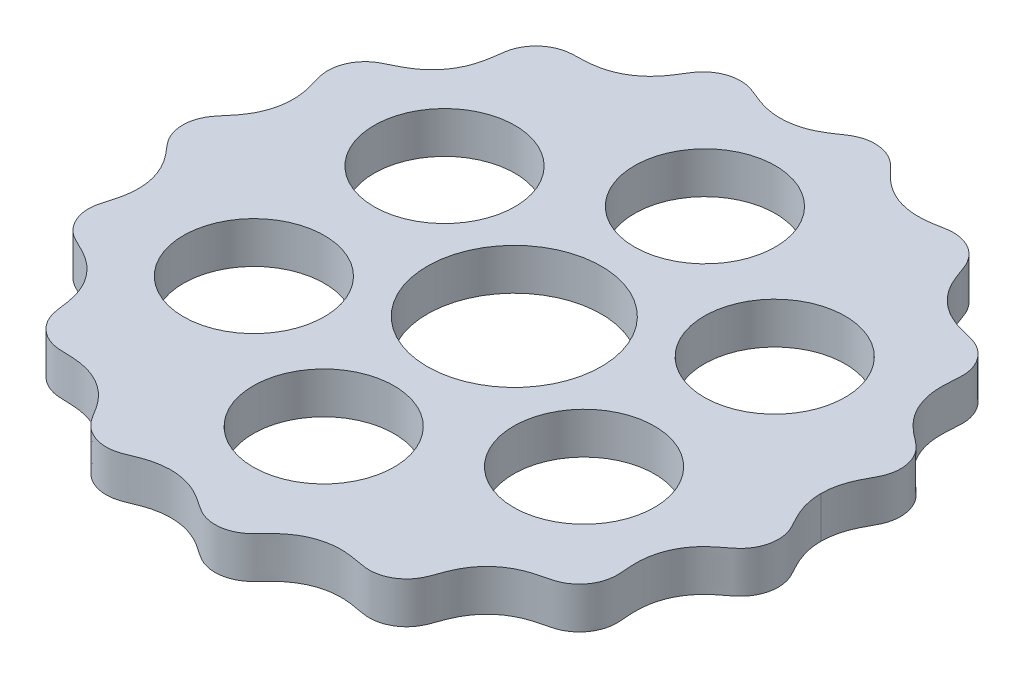
from build123d import *

# Parameters (mm, degrees)
SKETCH1_R           = 10.5
SKETCH1_R_2         = 8.5
BOSS_EXTRUDE1_DEPTH = 5


with BuildPart() as part:
    # Sketch1 → Boss-Extrude1 (new body)
    with BuildSketch(Plane(origin=(0, 0, 0), x_dir=(1, 0, 0), z_dir=(0, 1, 0))):
        with BuildLine():
            add(Edge.make_bspline(
                [(37, 0), (37, -0.03143727), (37.000453604, -0.094999987), (37.002494823, -0.209960319), (37.007935699, -0.365962041), (37.018130067, -0.547435978), (37.035778539, -0.762613663), (37.062295011, -1.000704503), (37.099596576, -1.254145629), (37.141666769, -1.490121949), (37.186730566, -1.707704996), (37.27599878, -2.086217996), (37.432607644, -2.61967024), (37.650272858, -3.191702622), (37.93344139, -3.795551093), (38.205952219, -4.315706499), (38.450459887, -4.76062227), (38.70692772, -5.235202277), (38.941768984, -5.756697541), (39.137855891, -6.378800099), (39.247955338, -7.103857197), (39.228570469, -7.939956238), (39.019285386, -8.855824089), (38.577559758, -9.823505319), (37.820964583, -10.754370621), (36.848063751, -11.434964366), (35.925475538, -12.170726431), (35.15516003, -12.931370117), (34.54379505, -13.69507461), (33.895237033, -14.741994379), (33.428420875, -15.89037885), (33.16127245, -17.104145416), (33.090755906, -18.276711654), (33.117928675, -19.134785899), (33.184630754, -19.922725011), (33.242632466, -20.644624385), (33.219628568, -21.437875666), (33.036316371, -22.28173929), (32.662226146, -23.128482681), (32.07870968, -23.926433825), (31.270520944, -24.647504284), (30.212930356, -25.19576041), (29.05618735, -25.42594367), (27.921165014, -25.714783041), (26.912865036, -26.088040866), (26.04670806, -26.526543792), (25.231490798, -27.070153578), (24.486296273, -27.71622491), (23.823206932, -28.456781999), (23.254813288, -29.28043732), (22.819009974, -30.105428972), (22.489240246, -30.904456359), (22.226168392, -31.656017359), (21.986325362, -32.344433223), (21.645702746, -33.067171886), (21.136896315, -33.772149992), (20.444596547, -34.405183963), (19.573466112, -34.908137767), (18.679093954, -35.191155104), (17.814153371, -35.279328837), (17.017950382, -35.212908103), (16.301803877, -35.076487107), (15.519474027, -34.928387551), (14.662477813, -34.814713427), (13.480415131, -34.769744423), (12.24114903, -34.919564924), (11.051981736, -35.275534422), (9.949378285, -35.820248955), (9.136432454, -36.351322247), (8.309098279, -37.037782148), (7.491403014, -37.876399022), (6.713712112, -38.763029071), (5.710099738, -39.404826424), (4.681547406, -39.744189192), (3.698738629, -39.8505626), (2.778395229, -39.751156366), (1.955929975, -39.487981912), (1.257453315, -39.111274685), (0.66127052, -38.700097997), (0.012246131, -38.248357139), (-0.717280827, -37.795796162), (-1.768012922, -37.270567489), (-2.95273679, -36.895066329), (-4.18067966, -36.725111536), (-5.411611299, -36.763370496), (-6.378691755, -36.910893684), (-7.422567545, -37.197831252), (-8.521082833, -37.628680278), (-9.596894828, -38.131330913), (-10.781414036, -38.320591212), (-11.865254321, -38.217684033), (-12.80999509, -37.9179101), (-13.765403055, -37.370059654), (-14.639711952, -36.510029041), (-15.224959633, -35.447056134), (-15.875186541, -34.432134448), (-16.722685045, -33.381987434), (-17.645169147, -32.549366783), (-18.695344862, -31.881164301), (-19.839308599, -31.403126169), (-20.793085274, -31.134677942), (-21.881721134, -30.964500418), (-23.08542905, -30.908652495), (-24.29883225, -30.933417715), (-25.48067958, -30.606197148), (-26.432898172, -30.052748184), (-27.164845045, -29.384446693), (-27.795906987, -28.497278622), (-28.22424747, -27.376816762), (-28.326856094, -26.193816745), (-28.502980453, -25.027046281), (-28.77642721, -23.979556749), (-29.132206305, -23.068277652), (-29.714540354, -21.983130932), (-30.47569585, -21.00467793), (-31.393252135, -20.166428114), (-32.373478982, -19.519081264), (-33.130172271, -19.113573458), (-33.84590289, -18.777371391), (-34.500084654, -18.46665169), (-35.175559662, -18.050104616), (-35.814710148, -17.469419425), (-36.360966849, -16.722076386), (-36.760254169, -15.817760445), (-36.980625548, -14.757313596), (-36.926633396, -13.567284637), (-36.547607451, -12.450425228), (-36.230236904, -11.323045641), (-36.049340213, -10.26320608), (-35.996011997, -9.293835891), (-36.059190915, -8.316040478), (-36.246094895, -7.347633334), (-36.555913141, -6.403126162), (-36.984986238, -5.49901541), (-37.4816085, -4.709168384), (-38.008605013, -4.023960492), (-38.528096971, -3.420524046), (-39.004092361, -2.868313104), (-39.352986229, -2.366627777), (-39.578197628, -1.930892753), (-39.717578718, -1.588781599), (-39.798314559, -1.352462416), (-39.865873622, -1.112280963), (-39.913167386, -0.899005121), (-39.945298995, -0.714032442), (-39.966442184, -0.560824818), (-39.979976403, -0.438104208), (-39.99012853, -0.31081675), (-39.99689741, -0.175935477), (-39.999435894, -0.08120679), (-40, -0.026915073), (-40, -1e-09)],
                knots=[0.06614426, 0.06614426, 0.06614426, 0.06614426, 0.06614426, 0.067102742, 0.068061224, 0.069019706, 0.069978188, 0.071895152, 0.073812116, 0.075273751, 0.076735387, 0.078197023, 0.079658659, 0.085505202, 0.091351745, 0.094275016, 0.097198288, 0.100954467, 0.104710646, 0.108466825, 0.112223004, 0.118069589, 0.123916173, 0.130338535, 0.136760898, 0.145879075, 0.154997253, 0.161421442, 0.167845631, 0.17426982, 0.18069401, 0.193736695, 0.200258038, 0.206779381, 0.211541823, 0.216304265, 0.221066707, 0.225829148, 0.232348859, 0.238868571, 0.245245472, 0.251622373, 0.260676895, 0.269731417, 0.276109562, 0.282487707, 0.288865852, 0.295243997, 0.301811097, 0.308378198, 0.314945298, 0.321512399, 0.326307116, 0.331101834, 0.335896552, 0.340691269, 0.347256117, 0.353820965, 0.360385813, 0.366950661, 0.371745379, 0.376540096, 0.381334814, 0.386129532, 0.392696632, 0.399263733, 0.412397934, 0.418776079, 0.425154223, 0.431532368, 0.437910513, 0.446965035, 0.456019557, 0.462396459, 0.46877336, 0.475293071, 0.481812782, 0.486575224, 0.491337666, 0.496100107, 0.500862549, 0.507383892, 0.513905235, 0.526947921, 0.53337211, 0.539796299, 0.546220489, 0.552644678, 0.561762855, 0.570881032, 0.577303395, 0.583725757, 0.590229974, 0.596734191, 0.606102622, 0.615471053, 0.621977695, 0.628484337, 0.641497621, 0.648004263, 0.654510905, 0.661017547, 0.667524189, 0.67689262, 0.686261051, 0.692765268, 0.699269485, 0.705691847, 0.71211421, 0.721232387, 0.730350565, 0.736774754, 0.743198943, 0.749623132, 0.756047322, 0.769090007, 0.77561135, 0.782132693, 0.786895135, 0.791657577, 0.796420019, 0.80118246, 0.807702171, 0.814221883, 0.820598784, 0.826975685, 0.836030207, 0.845084729, 0.851462874, 0.857841019, 0.864219164, 0.870597309, 0.877164409, 0.88373151, 0.89029861, 0.896865711, 0.901660428, 0.906455146, 0.911249864, 0.916044581, 0.917685793, 0.919327005, 0.920968217, 0.922609429, 0.924250641, 0.925071247, 0.925891853, 0.926712459, 0.927533065, 0.928353671, 0.929174277, 0.929174277, 0.929174277, 0.929174277, 0.929174277], degree=4))
            add(Edge.make_bspline(
                [(-40, -1e-09), (-40, 0.026915073), (-39.999435898, 0.081102132), (-39.996897439, 0.173969707), (-39.990128591, 0.308512197), (-39.979976315, 0.43784111), (-39.96644193, 0.561596862), (-39.949527385, 0.683811751), (-39.92923545, 0.806418669), (-39.905569953, 0.929082564), (-39.878536112, 1.05108509), (-39.840542165, 1.202393225), (-39.788245672, 1.382030281), (-39.717511124, 1.588706673), (-39.612678592, 1.8465975), (-39.4787487, 2.123083835), (-39.310663945, 2.414096923), (-39.104945299, 2.715281305), (-38.881313352, 3.003243592), (-38.647115103, 3.282501031), (-38.34984736, 3.627713203), (-37.95291863, 4.096180366), (-37.481683121, 4.709256859), (-36.984926096, 5.498908372), (-36.555971315, 6.403267497), (-36.170215472, 7.578337946), (-35.9868127, 8.798814705), (-36.009059108, 10.024440425), (-36.200622014, 11.152023378), (-36.408520549, 11.955019807), (-36.630718407, 12.680349542), (-36.821563566, 13.341696839), (-36.992348492, 14.33180594), (-36.904909082, 15.422182159), (-36.504382838, 16.524262833), (-35.814997617, 17.469697467), (-35.175412137, 18.050006312), (-34.5001255, 18.466591368), (-33.84600501, 18.777687977), (-32.905560624, 19.218134843), (-31.725163504, 19.887218348), (-30.439584969, 20.966645125), (-29.285197967, 22.586057403), (-28.686625036, 24.137217697), (-28.434119871, 25.439027518), (-28.31164158, 26.439459997), (-28.21864172, 27.126579635), (-28.036118522, 27.870890122), (-27.694662989, 28.638492196), (-27.164686183, 29.384972568), (-26.433444718, 30.052566346), (-25.634630631, 30.516068805), (-24.823088132, 30.788827784), (-24.04685872, 30.899230803), (-23.334712945, 30.920266621), (-22.306444557, 30.937751057), (-20.963494482, 31.058617768), (-19.344902311, 31.506985138), (-17.613398371, 32.506669405), (-16.415804752, 33.684227657), (-15.639656073, 34.786823183), (-15.110379913, 35.668587511), (-14.736089473, 36.274805934), (-14.252362947, 36.891838815), (-13.610375494, 37.458275746), (-12.809563546, 37.918317809), (-11.865789642, 38.217794604), (-10.954330273, 38.303527797), (-10.118839611, 38.215435923), (-9.382986221, 38.00135041), (-8.741423229, 37.738330824), (-7.813784142, 37.344183911), (-6.560131184, 36.91195486), (-4.917500499, 36.654754125), (-2.937854825, 36.844776382), (-1.360254549, 37.418406773), (-0.190612674, 38.106118753), (0.66104769, 38.700344294), (1.25752551, 39.11128049), (1.955942055, 39.487804143), (2.778297019, 39.751545742), (3.94176, 39.875855803), (5.096453052, 39.671677477), (6.084466159, 39.202219931), (6.856533473, 38.559253291), (7.333854157, 38.063319478), (7.850909823, 37.508190885), (8.442374814, 36.92670684), (9.323110596, 36.196912537), (10.58841665, 35.435636692), (11.999200644, 34.94870835), (13.48033229, 34.769799778), (14.662523081, 34.814686453), (15.519442707, 34.928402455), (16.301826743, 35.076481327), (17.01792965, 35.21290787), (17.814178726, 35.27933238), (18.679056308, 35.191146999), (19.573524947, 34.908152618), (20.444504658, 34.405159426), (21.137044029, 33.772190195), (21.591803381, 33.141505578), (21.869639533, 32.592625152), (22.075891139, 32.086193752), (22.226561366, 31.656080042), (22.376591176, 31.226097871), (22.593668003, 30.651444897), (22.86151291, 30.024879345), (23.255100485, 29.280174836), (23.822818619, 28.457094584), (24.649069231, 27.534594711), (25.802527601, 26.61516732), (27.218058872, 25.905303721), (28.817567995, 25.472660001), (30.452832349, 25.14875342), (31.698805724, 24.383263182), (32.56091801, 23.351770837), (33.037621539, 22.281751264), (33.218869869, 21.437861265), (33.242984107, 20.64464847), (33.184772246, 19.922675951), (33.096291135, 18.887971334), (33.085336205, 17.531197285), (33.377495648, 15.878125019), (34.202660288, 14.068701252), (35.246780487, 12.774733869), (36.247889348, 11.905159004), (37.053074749, 11.298868113), (37.601617193, 10.874775338), (38.154972669, 10.344538529), (38.64897071, 9.665047684), (39.030511654, 8.832802317), (39.242952499, 7.865782472), (39.245093638, 6.94215806), (39.075312522, 6.10308858), (38.783182879, 5.375443563), (38.444617083, 4.748588598), (38.126578469, 4.173031944), (37.854861766, 3.633998474), (37.633034591, 3.131674523), (37.47857496, 2.727184292), (37.362612428, 2.374730281), (37.2774171, 2.077549654), (37.216377239, 1.837879163), (37.162604445, 1.596443845), (37.116253691, 1.353582746), (37.077446812, 1.109379842), (37.050179424, 0.893728529), (37.031634183, 0.710857807), (37.019415923, 0.558351339), (37.011589025, 0.433066649), (37.00424606, 0.269586224), (37.00097986, 0.133534053), (37, 0.053352873), (37, 0)],
                knots=[0.070825729, 0.070825729, 0.070825729, 0.070825729, 0.070825729, 0.071646335, 0.072466941, 0.073287547, 0.074108153, 0.074928759, 0.075749365, 0.076569971, 0.077390577, 0.078211183, 0.079031789, 0.080673002, 0.082314214, 0.083955426, 0.086352785, 0.088750144, 0.091147503, 0.093544862, 0.095942221, 0.09833958, 0.103134298, 0.109701399, 0.1162685, 0.122835601, 0.129402703, 0.142158993, 0.148537139, 0.154915284, 0.159442546, 0.163969807, 0.168497068, 0.17302433, 0.185778133, 0.192297845, 0.198817557, 0.203579999, 0.208342441, 0.213104883, 0.217867326, 0.230910013, 0.243952699, 0.256801079, 0.269649459, 0.274208548, 0.278767637, 0.283326726, 0.287885815, 0.294308178, 0.300730541, 0.307234758, 0.313738976, 0.318423192, 0.323107408, 0.327791624, 0.33247584, 0.345489125, 0.35850241, 0.371515695, 0.38452898, 0.389213196, 0.393897412, 0.398581628, 0.403265844, 0.409770061, 0.416274278, 0.422696641, 0.429119005, 0.433678094, 0.438237183, 0.442796272, 0.447355361, 0.46020374, 0.47305212, 0.486094807, 0.499137494, 0.503899936, 0.508662378, 0.51342482, 0.518187263, 0.524706974, 0.531226686, 0.54398049, 0.548507751, 0.553035012, 0.557562274, 0.562089535, 0.568467681, 0.574845826, 0.587602117, 0.600736319, 0.60730342, 0.613870521, 0.618665239, 0.623459957, 0.628254676, 0.633049394, 0.639614242, 0.64617909, 0.652743939, 0.659308787, 0.664103505, 0.666500865, 0.668898224, 0.673692942, 0.676090301, 0.67848766, 0.685054761, 0.691621862, 0.698188963, 0.704756064, 0.717512355, 0.730268646, 0.739323169, 0.748377691, 0.761131495, 0.767651207, 0.774170918, 0.778933361, 0.783695803, 0.788458245, 0.793220687, 0.806263374, 0.819306061, 0.832154441, 0.84500282, 0.849561909, 0.854120998, 0.858680087, 0.863239176, 0.869661539, 0.876083903, 0.88258812, 0.889092337, 0.893776553, 0.898460769, 0.903144985, 0.907829201, 0.911082522, 0.914335844, 0.917589165, 0.919215826, 0.920842486, 0.922469147, 0.924095807, 0.925722468, 0.927349129, 0.928975789, 0.92978912, 0.93060245, 0.93141578, 0.932229111, 0.933855771, 0.933855771, 0.933855771, 0.933855771, 0.933855771], degree=4))
        make_face()
        with Locations(Location((0, 0, 0), (0, 0, 270))):
            Circle(SKETCH1_R, mode=Mode.SUBTRACT)
        with Locations(Location((0, 23, 0), (0, 0, 270))):
            Circle(SKETCH1_R_2, mode=Mode.SUBTRACT)
        with Locations(Location((19.918584287, 11.5, 0), (0, 0, 270))):
            Circle(SKETCH1_R_2, mode=Mode.SUBTRACT)
        with Locations(Location((19.918584287, -11.5, 0), (0, 0, 270))):
            Circle(SKETCH1_R_2, mode=Mode.SUBTRACT)
        with Locations(Location((0, -23, 0), (0, 0, 270))):
            Circle(SKETCH1_R_2, mode=Mode.SUBTRACT)
        with Locations(Location((-19.918584287, -11.5, 0), (0, 0, 270))):
            Circle(SKETCH1_R_2, mode=Mode.SUBTRACT)
        with Locations(Location((-19.918584287, 11.5, 0), (0, 0, 270))):
            Circle(SKETCH1_R_2, mode=Mode.SUBTRACT)
    extrude(amount=BOSS_EXTRUDE1_DEPTH)


solid = part.part
